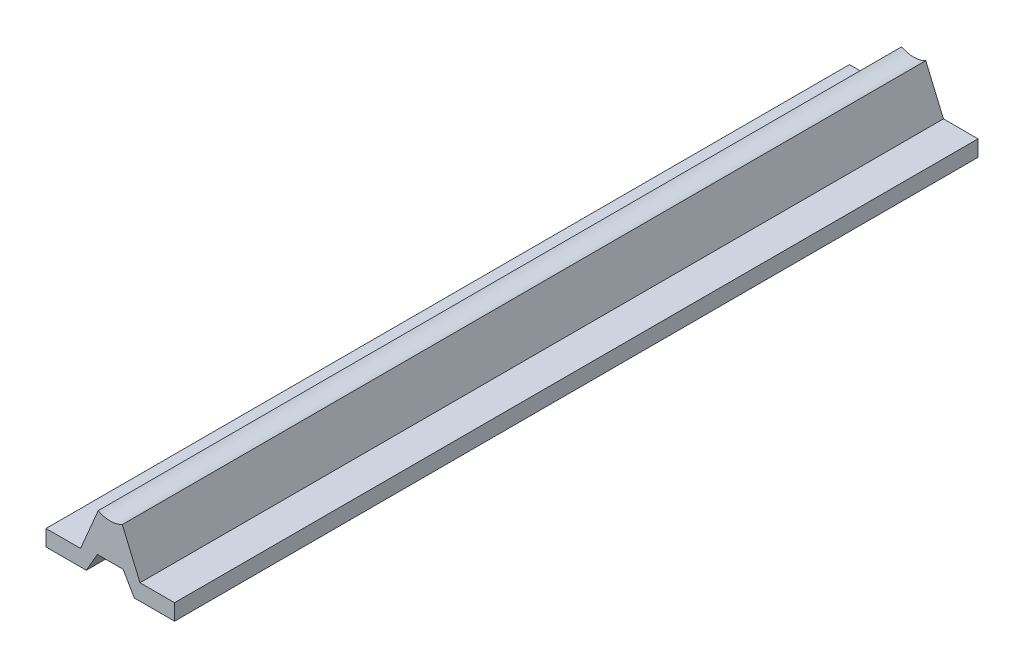
from build123d import *

# Parameters (mm, degrees)
BOSS_EXTRUDE1_DEPTH = 250


with BuildPart() as part:
    # Sketch1 → Boss-Extrude1 (new body)
    with BuildSketch(Plane.XY):
        with BuildLine():
            Line((-20, -25), (-7.464101615, -25))
            Line((-7.464101615, -25), (-4, -19))
            Line((-4, -19), (4, -19))
            Line((4, -19), (7.464101615, -25))
            Line((7.464101615, -25), (20, -25))
            Line((20, -25), (20, -20))
            Line((20, -20), (9.25, -20))
            Line((9.25, -20), (3.75, -7.066647013))
            ThreePointArc((3.75, -7.066647013), (0, -8), (-3.75, -7.066647013))
            Line((-3.75, -7.066647013), (-9.25, -20))
            Line((-9.25, -20), (-20, -20))
            Line((-20, -20), (-20, -25))
        make_face()
    extrude(amount=BOSS_EXTRUDE1_DEPTH)


solid = part.part
